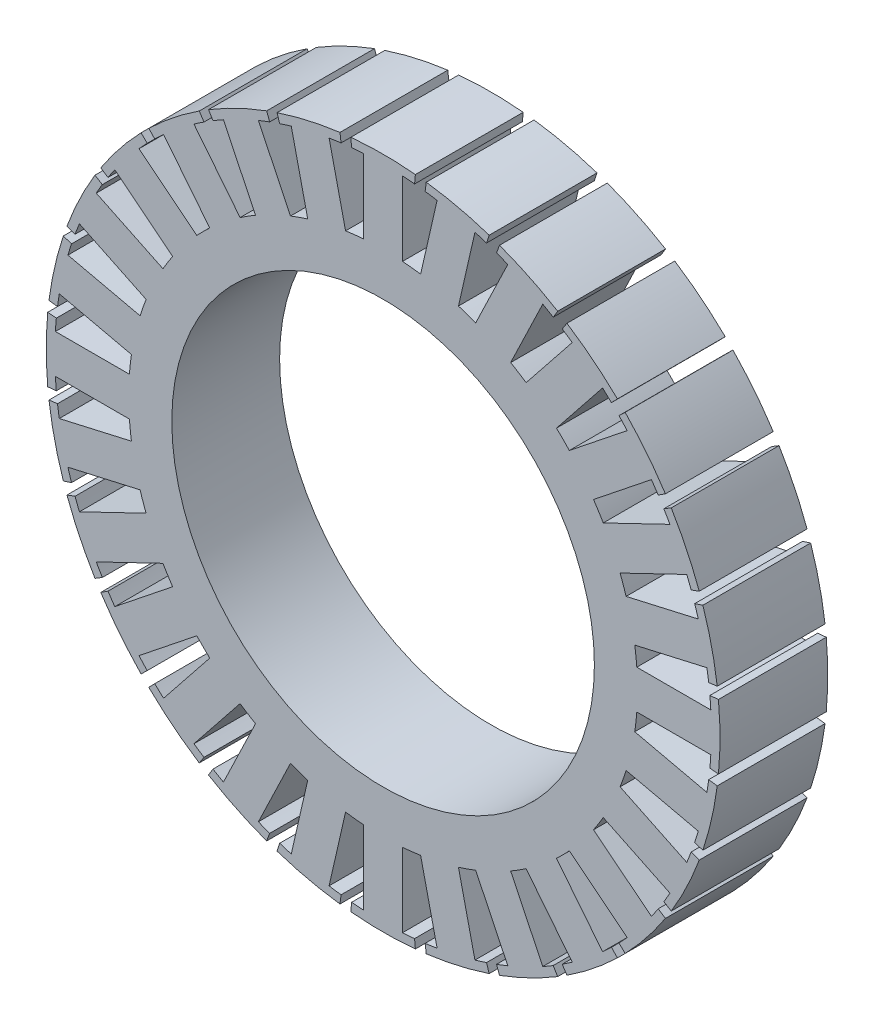
from build123d import *

# Parameters (mm, degrees)
SKETCH2_R           = 19.6
BOSS_EXTRUDE1_DEPTH = 10


with BuildPart() as part:
    # Sketch2 → Boss-Extrude1 (new body)
    with BuildSketch(Plane.XY):
        with BuildLine():
            Line((-1.8, 30.396751471), (-1.8, 23.53125581))
            ThreePointArc((-1.8, 23.53125581), (-2.642361636, 23.451608153), (-3.481326778, 23.341815779))
            Line((-3.481326778, 23.341815779), (-5.009043285, 30.03517913))
            ThreePointArc((-5.009043285, 30.03517913), (-4.454896593, 30.122357085), (-3.899237976, 30.199311966))
            Line((-3.899237976, 30.199311966), (-4.00168101, 30.992725745))
            ThreePointArc((-4.00168101, 30.992725745), (-6.953779186, 30.466497256), (-9.841849722, 29.659745347))
            Line((-9.841849722, 29.659745347), (-9.589898369, 28.900455866))
            ThreePointArc((-9.589898369, 28.900455866), (-9.055877783, 29.072213152), (-8.518783769, 29.234103768))
            Line((-8.518783769, 29.234103768), (-6.991067262, 22.540740417))
            ThreePointArc((-6.991067262, 22.540740417), (-7.794585862, 22.275646595), (-8.588085295, 21.981919638))
            Line((-8.588085295, 21.981919638), (-11.566912223, 28.167517491))
            ThreePointArc((-11.566912223, 28.167517491), (-11.046058066, 28.375818952), (-10.521455043, 28.574490088))
            Line((-10.521455043, 28.574490088), (-10.797880791, 29.325215607))
            ThreePointArc((-10.797880791, 29.325215607), (-13.558866847, 28.155277122), (-16.195008237, 26.726096015))
            Line((-16.195008237, 26.726096015), (-15.780416026, 26.041907957))
            ThreePointArc((-15.780416026, 26.041907957), (-15.298004043, 26.328189689), (-14.810400148, 26.60553603))
            Line((-14.810400148, 26.60553603), (-11.831573219, 20.419938177))
            ThreePointArc((-11.831573219, 20.419938177), (-12.555957006, 19.982691102), (-13.264201354, 19.519758258))
            Line((-13.264201354, 19.519758258), (-17.544767883, 24.887418908))
            ThreePointArc((-17.544767883, 24.887418908), (-17.083324063, 25.20639877), (-16.61608242, 25.51682396))
            Line((-16.61608242, 25.51682396), (-17.052629741, 26.187216708))
            ThreePointArc((-17.052629741, 26.187216708), (-19.484056308, 24.432233827), (-21.736081415, 22.45228863))
            Line((-21.736081415, 22.45228863), (-21.179637731, 21.877510041))
            ThreePointArc((-21.179637731, 21.877510041), (-20.773024501, 22.263960858), (-20.35936122, 22.642855622))
            Line((-20.35936122, 22.642855622), (-16.078794691, 17.275194971))
            ThreePointArc((-16.078794691, 17.275194971), (-16.687720036, 16.687720036), (-17.275194971, 16.078794691))
            Line((-17.275194971, 16.078794691), (-22.642855622, 20.35936122))
            ThreePointArc((-22.642855622, 20.35936122), (-22.263960858, 20.773024501), (-21.877510041, 21.179637731))
            Line((-21.877510041, 21.179637731), (-22.45228863, 21.736081415))
            ThreePointArc((-22.45228863, 21.736081415), (-24.432233827, 19.484056308), (-26.187216708, 17.052629741))
            Line((-26.187216708, 17.052629741), (-25.51682396, 16.61608242))
            ThreePointArc((-25.51682396, 16.61608242), (-25.20639877, 17.083324063), (-24.887418908, 17.544767883))
            Line((-24.887418908, 17.544767883), (-19.519758258, 13.264201354))
            ThreePointArc((-19.519758258, 13.264201354), (-19.982691102, 12.555957006), (-20.419938177, 11.831573219))
            Line((-20.419938177, 11.831573219), (-26.60553603, 14.810400148))
            ThreePointArc((-26.60553603, 14.810400148), (-26.328189689, 15.298004043), (-26.041907957, 15.780416026))
            Line((-26.041907957, 15.780416026), (-26.726096015, 16.195008237))
            ThreePointArc((-26.726096015, 16.195008237), (-28.155277122, 13.558866847), (-29.325215607, 10.797880791))
            Line((-29.325215607, 10.797880791), (-28.574490088, 10.521455043))
            ThreePointArc((-28.574490088, 10.521455043), (-28.375818952, 11.046058066), (-28.167517491, 11.566912223))
            Line((-28.167517491, 11.566912223), (-21.981919638, 8.588085295))
            ThreePointArc((-21.981919638, 8.588085295), (-22.275646595, 7.794585862), (-22.540740417, 6.991067262))
            Line((-22.540740417, 6.991067262), (-29.234103768, 8.518783769))
            ThreePointArc((-29.234103768, 8.518783769), (-29.072213152, 9.055877783), (-28.900455866, 9.589898369))
            Line((-28.900455866, 9.589898369), (-29.659745347, 9.841849722))
            ThreePointArc((-29.659745347, 9.841849722), (-30.466497256, 6.953779186), (-30.992725745, 4.00168101))
            Line((-30.992725745, 4.00168101), (-30.199311966, 3.899237976))
            ThreePointArc((-30.199311966, 3.899237976), (-30.122357085, 4.454896593), (-30.03517913, 5.009043285))
            Line((-30.03517913, 5.009043285), (-23.341815779, 3.481326778))
            ThreePointArc((-23.341815779, 3.481326778), (-23.451608153, 2.642361636), (-23.53125581, 1.8))
            Line((-23.53125581, 1.8), (-30.396751471, 1.8))
            ThreePointArc((-30.396751471, 1.8), (-30.358434453, 2.359651997), (-30.30981424, 2.918503164))
            Line((-30.30981424, 2.918503164), (-31.106131199, 2.995179766))
            ThreePointArc((-31.106131199, 2.995179766), (-31.25, 0), (-31.106131199, -2.995179766))
            Line((-31.106131199, -2.995179766), (-30.30981424, -2.918503164))
            ThreePointArc((-30.30981424, -2.918503164), (-30.358434453, -2.359651997), (-30.396751471, -1.8))
            Line((-30.396751471, -1.8), (-23.53125581, -1.8))
            ThreePointArc((-23.53125581, -1.8), (-23.451608153, -2.642361636), (-23.341815779, -3.481326778))
            Line((-23.341815779, -3.481326778), (-30.03517913, -5.009043285))
            ThreePointArc((-30.03517913, -5.009043285), (-30.122357085, -4.454896593), (-30.199311966, -3.899237976))
            Line((-30.199311966, -3.899237976), (-30.992725745, -4.00168101))
            ThreePointArc((-30.992725745, -4.00168101), (-30.466497256, -6.953779186), (-29.659745347, -9.841849722))
            Line((-29.659745347, -9.841849722), (-28.900455866, -9.589898369))
            ThreePointArc((-28.900455866, -9.589898369), (-29.072213152, -9.055877783), (-29.234103768, -8.518783769))
            Line((-29.234103768, -8.518783769), (-22.540740417, -6.991067262))
            ThreePointArc((-22.540740417, -6.991067262), (-22.275646595, -7.794585862), (-21.981919638, -8.588085295))
            Line((-21.981919638, -8.588085295), (-28.167517491, -11.566912223))
            ThreePointArc((-28.167517491, -11.566912223), (-28.375818952, -11.046058066), (-28.574490088, -10.521455043))
            Line((-28.574490088, -10.521455043), (-29.325215607, -10.797880791))
            ThreePointArc((-29.325215607, -10.797880791), (-28.155277122, -13.558866847), (-26.726096015, -16.195008237))
            Line((-26.726096015, -16.195008237), (-26.041907957, -15.780416026))
            ThreePointArc((-26.041907957, -15.780416026), (-26.328189689, -15.298004043), (-26.60553603, -14.810400148))
            Line((-26.60553603, -14.810400148), (-20.419938177, -11.831573219))
            ThreePointArc((-20.419938177, -11.831573219), (-19.982691102, -12.555957006), (-19.519758258, -13.264201354))
            Line((-19.519758258, -13.264201354), (-24.887418908, -17.544767883))
            ThreePointArc((-24.887418908, -17.544767883), (-25.20639877, -17.083324063), (-25.51682396, -16.61608242))
            Line((-25.51682396, -16.61608242), (-26.187216708, -17.052629741))
            ThreePointArc((-26.187216708, -17.052629741), (-24.432233827, -19.484056308), (-22.45228863, -21.736081415))
            Line((-22.45228863, -21.736081415), (-21.877510041, -21.179637731))
            ThreePointArc((-21.877510041, -21.179637731), (-22.263960858, -20.773024501), (-22.642855622, -20.35936122))
            Line((-22.642855622, -20.35936122), (-17.275194971, -16.078794691))
            ThreePointArc((-17.275194971, -16.078794691), (-16.687720036, -16.687720036), (-16.078794691, -17.275194971))
            Line((-16.078794691, -17.275194971), (-20.35936122, -22.642855622))
            ThreePointArc((-20.35936122, -22.642855622), (-20.773024501, -22.263960858), (-21.179637731, -21.877510041))
            Line((-21.179637731, -21.877510041), (-21.736081415, -22.45228863))
            ThreePointArc((-21.736081415, -22.45228863), (-19.484056308, -24.432233827), (-17.052629741, -26.187216708))
            Line((-17.052629741, -26.187216708), (-16.61608242, -25.51682396))
            ThreePointArc((-16.61608242, -25.51682396), (-17.083324063, -25.20639877), (-17.544767883, -24.887418908))
            Line((-17.544767883, -24.887418908), (-13.264201354, -19.519758258))
            ThreePointArc((-13.264201354, -19.519758258), (-12.555957006, -19.982691102), (-11.831573219, -20.419938177))
            Line((-11.831573219, -20.419938177), (-14.810400148, -26.60553603))
            ThreePointArc((-14.810400148, -26.60553603), (-15.298004043, -26.328189689), (-15.780416026, -26.041907957))
            Line((-15.780416026, -26.041907957), (-16.195008237, -26.726096015))
            ThreePointArc((-16.195008237, -26.726096015), (-13.558866847, -28.155277122), (-10.797880791, -29.325215607))
            Line((-10.797880791, -29.325215607), (-10.521455043, -28.574490088))
            ThreePointArc((-10.521455043, -28.574490088), (-11.046058066, -28.375818952), (-11.566912223, -28.167517491))
            Line((-11.566912223, -28.167517491), (-8.588085295, -21.981919638))
            ThreePointArc((-8.588085295, -21.981919638), (-7.794585862, -22.275646595), (-6.991067262, -22.540740417))
            Line((-6.991067262, -22.540740417), (-8.518783769, -29.234103768))
            ThreePointArc((-8.518783769, -29.234103768), (-9.055877783, -29.072213152), (-9.589898369, -28.900455866))
            Line((-9.589898369, -28.900455866), (-9.841849722, -29.659745347))
            ThreePointArc((-9.841849722, -29.659745347), (-6.953779186, -30.466497256), (-4.00168101, -30.992725745))
            Line((-4.00168101, -30.992725745), (-3.899237976, -30.199311966))
            ThreePointArc((-3.899237976, -30.199311966), (-4.454896593, -30.122357085), (-5.009043285, -30.03517913))
            Line((-5.009043285, -30.03517913), (-3.481326778, -23.341815779))
            ThreePointArc((-3.481326778, -23.341815779), (-2.642361636, -23.451608153), (-1.8, -23.53125581))
            Line((-1.8, -23.53125581), (-1.8, -30.396751471))
            ThreePointArc((-1.8, -30.396751471), (-2.359651997, -30.358434453), (-2.918503164, -30.30981424))
            Line((-2.918503164, -30.30981424), (-2.995179766, -31.106131199))
            ThreePointArc((-2.995179766, -31.106131199), (0, -31.25), (2.995179766, -31.106131199))
            Line((2.995179766, -31.106131199), (2.918503164, -30.30981424))
            ThreePointArc((2.918503164, -30.30981424), (2.359651997, -30.358434453), (1.8, -30.396751471))
            Line((1.8, -30.396751471), (1.8, -23.53125581))
            ThreePointArc((1.8, -23.53125581), (2.642361636, -23.451608153), (3.481326778, -23.341815779))
            Line((3.481326778, -23.341815779), (5.009043285, -30.03517913))
            ThreePointArc((5.009043285, -30.03517913), (4.454896593, -30.122357085), (3.899237976, -30.199311966))
            Line((3.899237976, -30.199311966), (4.00168101, -30.992725745))
            ThreePointArc((4.00168101, -30.992725745), (6.953779186, -30.466497256), (9.841849722, -29.659745347))
            Line((9.841849722, -29.659745347), (9.589898369, -28.900455866))
            ThreePointArc((9.589898369, -28.900455866), (9.055877783, -29.072213152), (8.518783769, -29.234103768))
            Line((8.518783769, -29.234103768), (6.991067262, -22.540740417))
            ThreePointArc((6.991067262, -22.540740417), (7.794585862, -22.275646595), (8.588085295, -21.981919638))
            Line((8.588085295, -21.981919638), (11.566912223, -28.167517491))
            ThreePointArc((11.566912223, -28.167517491), (11.046058066, -28.375818952), (10.521455043, -28.574490088))
            Line((10.521455043, -28.574490088), (10.797880791, -29.325215607))
            ThreePointArc((10.797880791, -29.325215607), (13.558866847, -28.155277122), (16.195008237, -26.726096015))
            Line((16.195008237, -26.726096015), (15.780416026, -26.041907957))
            ThreePointArc((15.780416026, -26.041907957), (15.298004043, -26.328189689), (14.810400148, -26.60553603))
            Line((14.810400148, -26.60553603), (11.831573219, -20.419938177))
            ThreePointArc((11.831573219, -20.419938177), (12.555957006, -19.982691102), (13.264201354, -19.519758258))
            Line((13.264201354, -19.519758258), (17.544767883, -24.887418908))
            ThreePointArc((17.544767883, -24.887418908), (17.083324063, -25.20639877), (16.61608242, -25.51682396))
            Line((16.61608242, -25.51682396), (17.052629741, -26.187216708))
            ThreePointArc((17.052629741, -26.187216708), (19.484056308, -24.432233827), (21.736081415, -22.45228863))
            Line((21.736081415, -22.45228863), (21.179637731, -21.877510041))
            ThreePointArc((21.179637731, -21.877510041), (20.773024501, -22.263960858), (20.35936122, -22.642855622))
            Line((20.35936122, -22.642855622), (16.078794691, -17.275194971))
            ThreePointArc((16.078794691, -17.275194971), (16.687720036, -16.687720036), (17.275194971, -16.078794691))
            Line((17.275194971, -16.078794691), (22.642855622, -20.35936122))
            ThreePointArc((22.642855622, -20.35936122), (22.263960858, -20.773024501), (21.877510041, -21.179637731))
            Line((21.877510041, -21.179637731), (22.45228863, -21.736081415))
            ThreePointArc((22.45228863, -21.736081415), (24.432233827, -19.484056308), (26.187216708, -17.052629741))
            Line((26.187216708, -17.052629741), (25.51682396, -16.61608242))
            ThreePointArc((25.51682396, -16.61608242), (25.20639877, -17.083324063), (24.887418908, -17.544767883))
            Line((24.887418908, -17.544767883), (19.519758258, -13.264201354))
            ThreePointArc((19.519758258, -13.264201354), (19.982691102, -12.555957006), (20.419938177, -11.831573219))
            Line((20.419938177, -11.831573219), (26.60553603, -14.810400148))
            ThreePointArc((26.60553603, -14.810400148), (26.328189689, -15.298004043), (26.041907957, -15.780416026))
            Line((26.041907957, -15.780416026), (26.726096015, -16.195008237))
            ThreePointArc((26.726096015, -16.195008237), (28.155277122, -13.558866847), (29.325215607, -10.797880791))
            Line((29.325215607, -10.797880791), (28.574490088, -10.521455043))
            ThreePointArc((28.574490088, -10.521455043), (28.375818952, -11.046058066), (28.167517491, -11.566912223))
            Line((28.167517491, -11.566912223), (21.981919638, -8.588085295))
            ThreePointArc((21.981919638, -8.588085295), (22.275646595, -7.794585862), (22.540740417, -6.991067262))
            Line((22.540740417, -6.991067262), (29.234103768, -8.518783769))
            ThreePointArc((29.234103768, -8.518783769), (29.072213152, -9.055877783), (28.900455866, -9.589898369))
            Line((28.900455866, -9.589898369), (29.659745347, -9.841849722))
            ThreePointArc((29.659745347, -9.841849722), (30.466497256, -6.953779186), (30.992725745, -4.00168101))
            Line((30.992725745, -4.00168101), (30.199311966, -3.899237976))
            ThreePointArc((30.199311966, -3.899237976), (30.122357085, -4.454896593), (30.03517913, -5.009043285))
            Line((30.03517913, -5.009043285), (23.341815779, -3.481326778))
            ThreePointArc((23.341815779, -3.481326778), (23.451608153, -2.642361636), (23.53125581, -1.8))
            Line((23.53125581, -1.8), (30.396751471, -1.8))
            ThreePointArc((30.396751471, -1.8), (30.358434453, -2.359651997), (30.30981424, -2.918503164))
            Line((30.30981424, -2.918503164), (31.106131199, -2.995179766))
            ThreePointArc((31.106131199, -2.995179766), (31.25, 0), (31.106131199, 2.995179766))
            Line((31.106131199, 2.995179766), (30.30981424, 2.918503164))
            ThreePointArc((30.30981424, 2.918503164), (30.358434453, 2.359651997), (30.396751471, 1.8))
            Line((30.396751471, 1.8), (23.53125581, 1.8))
            ThreePointArc((23.53125581, 1.8), (23.451608153, 2.642361636), (23.341815779, 3.481326778))
            Line((23.341815779, 3.481326778), (30.03517913, 5.009043285))
            ThreePointArc((30.03517913, 5.009043285), (30.122357085, 4.454896593), (30.199311966, 3.899237976))
            Line((30.199311966, 3.899237976), (30.992725745, 4.00168101))
            ThreePointArc((30.992725745, 4.00168101), (30.466497256, 6.953779186), (29.659745347, 9.841849722))
            Line((29.659745347, 9.841849722), (28.900455866, 9.589898369))
            ThreePointArc((28.900455866, 9.589898369), (29.072213152, 9.055877783), (29.234103768, 8.518783769))
            Line((29.234103768, 8.518783769), (22.540740417, 6.991067262))
            ThreePointArc((22.540740417, 6.991067262), (22.275646595, 7.794585862), (21.981919638, 8.588085295))
            Line((21.981919638, 8.588085295), (28.167517491, 11.566912223))
            ThreePointArc((28.167517491, 11.566912223), (28.375818952, 11.046058066), (28.574490088, 10.521455043))
            Line((28.574490088, 10.521455043), (29.325215607, 10.797880791))
            ThreePointArc((29.325215607, 10.797880791), (28.155277122, 13.558866847), (26.726096015, 16.195008237))
            Line((26.726096015, 16.195008237), (26.041907957, 15.780416026))
            ThreePointArc((26.041907957, 15.780416026), (26.328189689, 15.298004043), (26.60553603, 14.810400148))
            Line((26.60553603, 14.810400148), (20.419938177, 11.831573219))
            ThreePointArc((20.419938177, 11.831573219), (19.982691102, 12.555957006), (19.519758258, 13.264201354))
            Line((19.519758258, 13.264201354), (24.887418908, 17.544767883))
            ThreePointArc((24.887418908, 17.544767883), (25.20639877, 17.083324063), (25.51682396, 16.61608242))
            Line((25.51682396, 16.61608242), (26.187216708, 17.052629741))
            ThreePointArc((26.187216708, 17.052629741), (24.432233827, 19.484056308), (22.45228863, 21.736081415))
            Line((22.45228863, 21.736081415), (21.877510041, 21.179637731))
            ThreePointArc((21.877510041, 21.179637731), (22.263960858, 20.773024501), (22.642855622, 20.35936122))
            Line((22.642855622, 20.35936122), (17.275194971, 16.078794691))
            ThreePointArc((17.275194971, 16.078794691), (16.687720036, 16.687720036), (16.078794691, 17.275194971))
            Line((16.078794691, 17.275194971), (20.35936122, 22.642855622))
            ThreePointArc((20.35936122, 22.642855622), (20.773024501, 22.263960858), (21.179637731, 21.877510041))
            Line((21.179637731, 21.877510041), (21.736081415, 22.45228863))
            ThreePointArc((21.736081415, 22.45228863), (19.484056308, 24.432233827), (17.052629741, 26.187216708))
            Line((17.052629741, 26.187216708), (16.61608242, 25.51682396))
            ThreePointArc((16.61608242, 25.51682396), (17.083324063, 25.20639877), (17.544767883, 24.887418908))
            Line((17.544767883, 24.887418908), (13.264201354, 19.519758258))
            ThreePointArc((13.264201354, 19.519758258), (12.555957006, 19.982691102), (11.831573219, 20.419938177))
            Line((11.831573219, 20.419938177), (14.810400148, 26.60553603))
            ThreePointArc((14.810400148, 26.60553603), (15.298004043, 26.328189689), (15.780416026, 26.041907957))
            Line((15.780416026, 26.041907957), (16.195008237, 26.726096015))
            ThreePointArc((16.195008237, 26.726096015), (13.558866847, 28.155277122), (10.797880791, 29.325215607))
            Line((10.797880791, 29.325215607), (10.521455043, 28.574490088))
            ThreePointArc((10.521455043, 28.574490088), (11.046058066, 28.375818952), (11.566912223, 28.167517491))
            Line((11.566912223, 28.167517491), (8.588085295, 21.981919638))
            ThreePointArc((8.588085295, 21.981919638), (7.794585862, 22.275646595), (6.991067262, 22.540740417))
            Line((6.991067262, 22.540740417), (8.518783769, 29.234103768))
            ThreePointArc((8.518783769, 29.234103768), (9.055877783, 29.072213152), (9.589898369, 28.900455866))
            Line((9.589898369, 28.900455866), (9.841849722, 29.659745347))
            ThreePointArc((9.841849722, 29.659745347), (6.953779186, 30.466497256), (4.00168101, 30.992725745))
            Line((4.00168101, 30.992725745), (3.899237976, 30.199311966))
            ThreePointArc((3.899237976, 30.199311966), (4.454896593, 30.122357085), (5.009043285, 30.03517913))
            Line((5.009043285, 30.03517913), (3.481326778, 23.341815779))
            ThreePointArc((3.481326778, 23.341815779), (2.642361636, 23.451608153), (1.8, 23.53125581))
            Line((1.8, 23.53125581), (1.8, 30.396751471))
            ThreePointArc((1.8, 30.396751471), (2.359651997, 30.358434453), (2.918503164, 30.30981424))
            Line((2.918503164, 30.30981424), (2.995179766, 31.106131199))
            ThreePointArc((2.995179766, 31.106131199), (0, 31.25), (-2.995179766, 31.106131199))
            Line((-2.995179766, 31.106131199), (-2.918503164, 30.30981424))
            ThreePointArc((-2.918503164, 30.30981424), (-2.359651997, 30.358434453), (-1.8, 30.396751471))
        make_face()
        Circle(SKETCH2_R, mode=Mode.SUBTRACT)
    extrude(amount=-BOSS_EXTRUDE1_DEPTH)


solid = part.part
